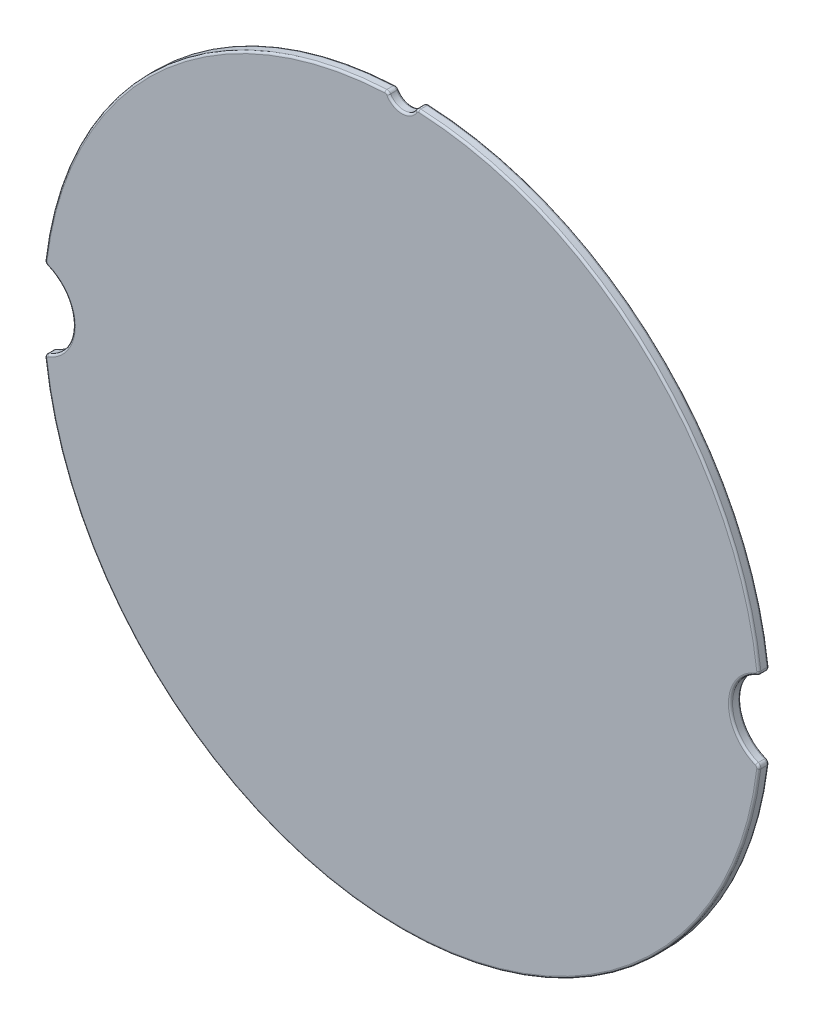
from build123d import *

# Parameters (mm, degrees)
BOSS_EXTRUDE1_DEPTH = 0.5
FILLET1_R           = 0.1
FILLET2_R           = 0.1


with BuildPart() as part:
    # Sketch1 → Boss-Extrude1 (new body)
    with BuildSketch(Plane.XY.offset(-13)):
        with BuildLine():
            ThreePointArc((0.826653793, 17.480464625), (0.722337253, 17.456755657), (0.645162885, 17.382673455))
            ThreePointArc((0.645162885, 17.382673455), (0, 17.015119335), (-0.645162885, 17.382673455))
            ThreePointArc((-0.645162885, 17.382673455), (-0.722337253, 17.456755657), (-0.826653793, 17.480464625))
            ThreePointArc((-0.826653793, 17.480464625), (-11.92734093, 12.805800964), (-17.37776975, 2.064732073))
            ThreePointArc((-17.37776975, 2.064732073), (-17.351211134, 1.939151306), (-17.253787879, 1.855577395))
            ThreePointArc((-17.253787879, 1.855577395), (-16, 0), (-17.253787879, -1.855577395))
            ThreePointArc((-17.253787879, -1.855577395), (-17.351211134, -1.939151306), (-17.37776975, -2.064732073))
            ThreePointArc((-17.37776975, -2.064732073), (0, -17.5), (17.37776975, -2.064732073))
            ThreePointArc((17.37776975, -2.064732073), (17.351211134, -1.939151306), (17.253787879, -1.855577395))
            ThreePointArc((17.253787879, -1.855577395), (16, 0), (17.253787879, 1.855577395))
            ThreePointArc((17.253787879, 1.855577395), (17.351211134, 1.939151306), (17.37776975, 2.064732073))
            ThreePointArc((17.37776975, 2.064732073), (11.92734093, 12.805800964), (0.826653793, 17.480464625))
        make_face()
    extrude(amount=-BOSS_EXTRUDE1_DEPTH)

    # Fillet1
    fillet1_edges = [part.edges().sort_by_distance(p)[0] for p in [
        (0, 17.015119335, -13.5),
        (-0.722337253, 17.456755657, -13.5),
        (-11.92734093, 12.805800964, -13.5),
        (-17.351211134, 1.939151306, -13.5),
        (-16, 0, -13.5),
        (-17.351211134, -1.939151306, -13.5),
        (0, -17.5, -13.5),
        (17.351211134, -1.939151306, -13.5),
        (16, 0, -13.5),
        (17.351211134, 1.939151306, -13.5),
        (11.92734093, 12.805800964, -13.5),
        (0.722337253, 17.456755657, -13.5),
    ]]
    fillet(fillet1_edges, radius=FILLET1_R)

    # Fillet2
    fillet2_edges = [part.edges().sort_by_distance(p)[0] for p in [
        (17.351211134, 1.939151306, -13),
        (16, 0, -13),
        (17.351211134, -1.939151306, -13),
        (0, -17.5, -13),
        (-17.351211134, -1.939151306, -13),
        (-16, 0, -13),
        (-17.351211134, 1.939151306, -13),
        (-11.92734093, 12.805800964, -13),
        (-0.722337253, 17.456755657, -13),
        (0, 17.015119335, -13),
        (0.722337253, 17.456755657, -13),
        (11.92734093, 12.805800964, -13),
    ]]
    fillet(fillet2_edges, radius=FILLET2_R)


solid = part.part
